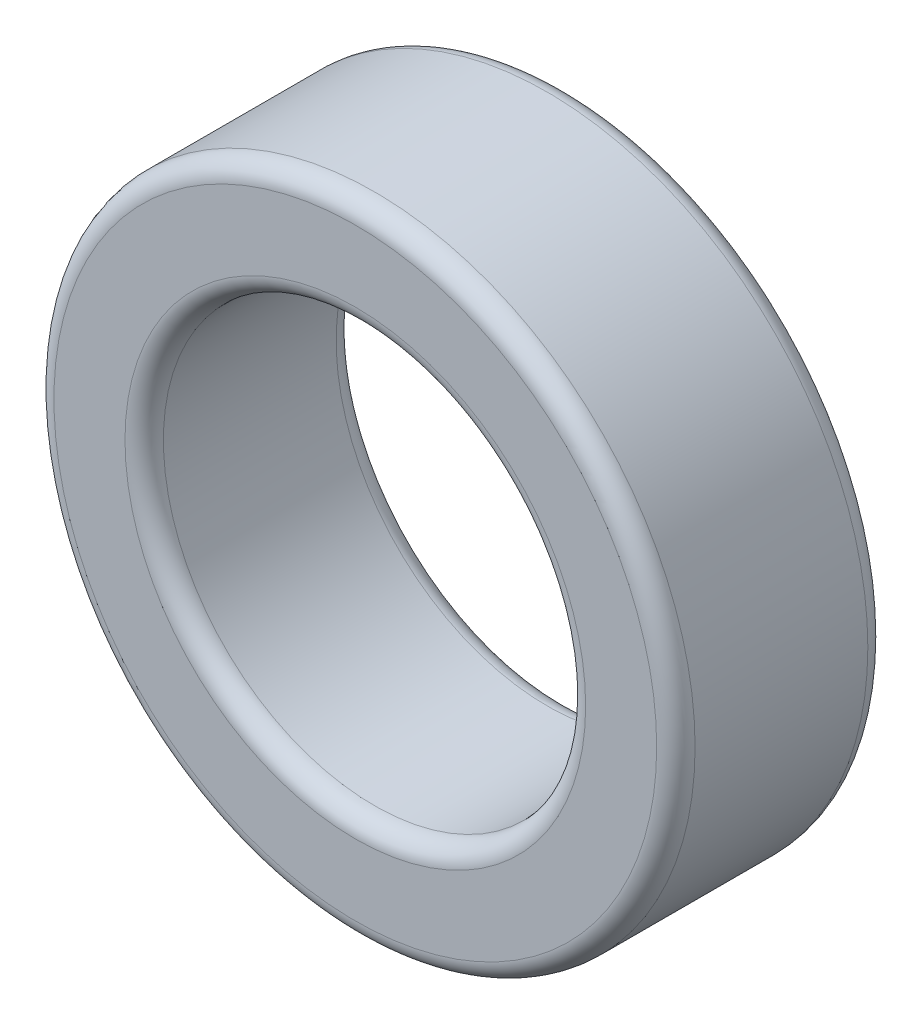
from build123d import *

# Parameters (mm, degrees)
SKETCH1_R           = 21.209
SKETCH1_R_2         = 13.97
BOSS_EXTRUDE1_DEPTH = 13.97
FILLET1_R           = 1.27


with BuildPart() as part:
    # Sketch1 → Boss-Extrude1 (new body)
    with BuildSketch(Plane.XY):
        Circle(SKETCH1_R)
        Circle(SKETCH1_R_2, mode=Mode.SUBTRACT)
    extrude(amount=BOSS_EXTRUDE1_DEPTH)

    # Fillet1
    fillet1_edges = [part.edges().sort_by_distance(p)[0] for p in [
        (-21.209, 0, 0),
        (-21.209, 0, 13.97),
        (-13.97, 0, 0),
        (-13.97, 0, 13.97),
    ]]
    fillet(fillet1_edges, radius=FILLET1_R)


solid = part.part
